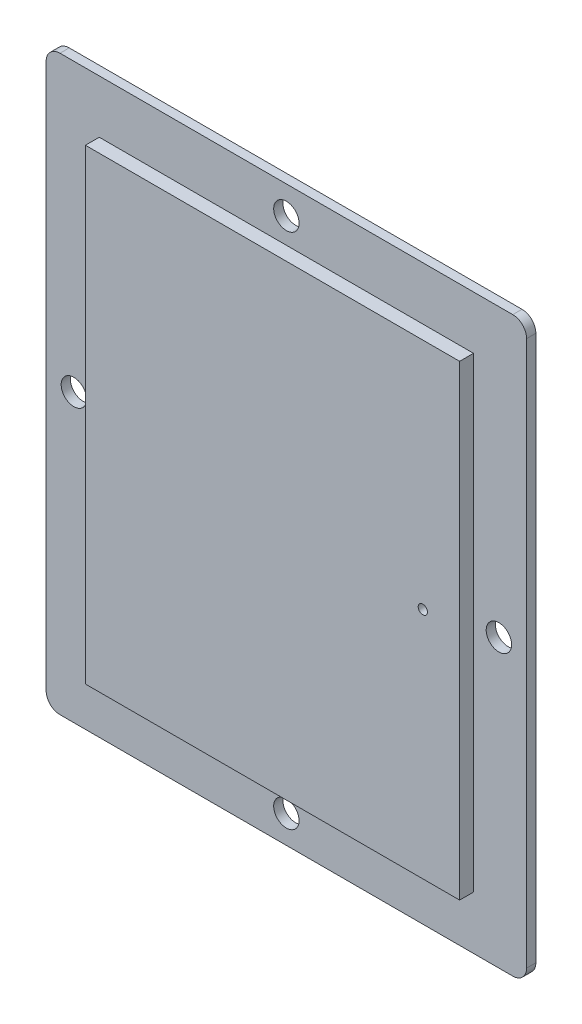
from build123d import *

# Parameters (mm, degrees)
SKETCH1_W           = 104
SKETCH1_H           = 124
BOSS_EXTRUDE1_DEPTH = 2
SKETCH4_W           = 81
SKETCH4_H           = 101
BOSS_EXTRUDE2_DEPTH = 3
SKETCH5_R           = 1
CUT_EXTRUDE1_DEPTH  = 162.916645222
FILLET1_R           = 3
SKETCH6_R           = 2.75
CUT_EXTRUDE3_DEPTH  = 162.867229543
SKETCH9_R           = 2.75
CUT_EXTRUDE4_DEPTH  = 162.867229543


with BuildPart() as part:
    # Sketch1 → Boss-Extrude1 (new body)
    with BuildSketch(Plane.XY):
        with Locations((52, 62)):
            Rectangle(SKETCH1_W, SKETCH1_H)
    extrude(amount=BOSS_EXTRUDE1_DEPTH)

    # Sketch4 → Boss-Extrude2 (add)
    with BuildSketch(Plane.XY.offset(2)):
        with Locations((52, 62)):
            Rectangle(SKETCH4_W, SKETCH4_H)
    extrude(amount=BOSS_EXTRUDE2_DEPTH)

    # Sketch5 → Cut-Extrude1 (cut, through all)
    with BuildSketch(Plane.XY.offset(5)):
        with Locations((84.533228661, 62)):
            Circle(SKETCH5_R)
    extrude(amount=-CUT_EXTRUDE1_DEPTH, mode=Mode.SUBTRACT)

    # Fillet1
    fillet1_edges = [part.edges().sort_by_distance(p)[0] for p in [
        (0, 0, 1),
        (104, 0, 1),
        (104, 124, 1),
        (0, 124, 1),
    ]]
    fillet(fillet1_edges, radius=FILLET1_R)

    # Sketch6 → Cut-Extrude3 (cut, through all)
    with BuildSketch(Plane.XY.offset(2)):
        with Locations((98, 62)):
            Circle(SKETCH6_R)
        with Locations((6, 62)):
            Circle(SKETCH6_R)
    extrude(amount=-CUT_EXTRUDE3_DEPTH, mode=Mode.SUBTRACT)

    # Sketch9 → Cut-Extrude4 (cut, through all)
    with BuildSketch(Plane.XY.offset(2)):
        with Locations((52, 6)):
            Circle(SKETCH9_R)
        with Locations((52, 118)):
            Circle(SKETCH9_R)
    extrude(amount=-CUT_EXTRUDE4_DEPTH, mode=Mode.SUBTRACT)


solid = part.part
